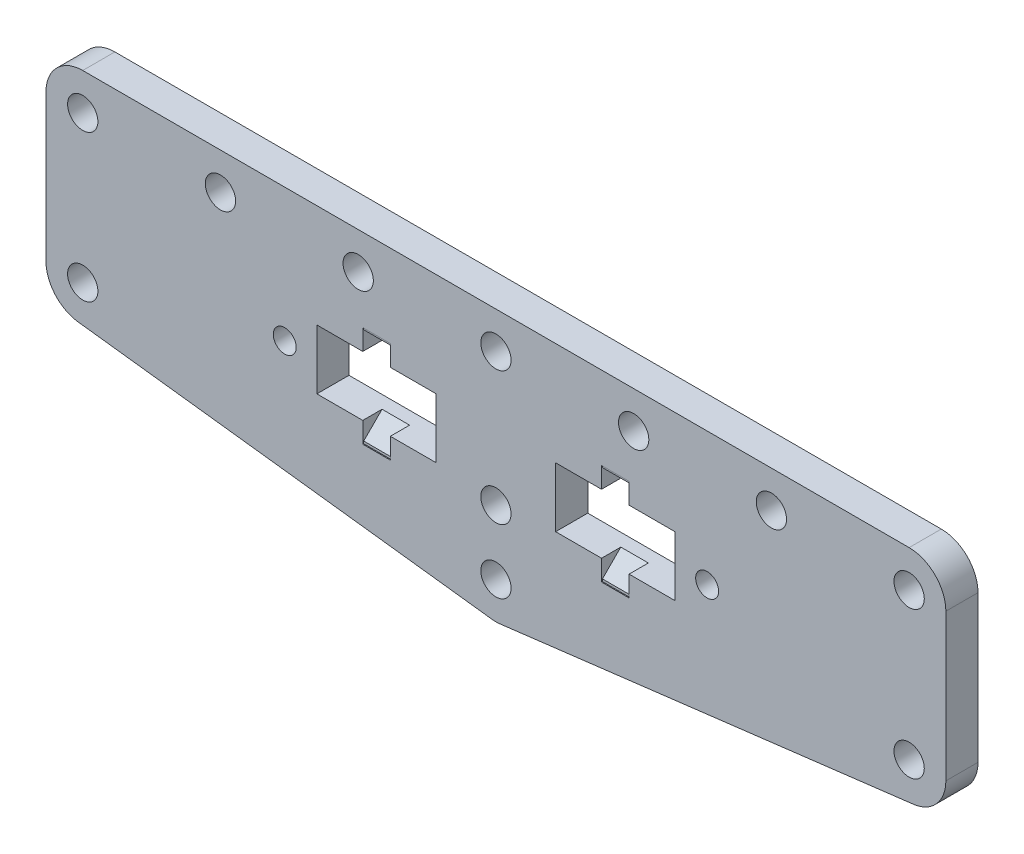
from build123d import *

# Parameters (mm, degrees)
SZKIC1_R                    = 1.65
DODANIE_WYCI_GNI_CIE1_DEPTH = 3.5
SZKIC2_W                    = 13
SZKIC2_H                    = 6.5
WYTNIJ_WYCI_GNI_CIE1_DEPTH  = 4
SZKIC3_R                    = 1.25
WYTNIJ_WYCI_GNI_CIE2_DEPTH  = 4
SZKIC4_R                    = 1.65
WYTNIJ_WYCI_GNI_CIE3_DEPTH  = 4
SZKIC5_W                    = 3
SZKIC5_H                    = 11
WYTNIJ_WYCI_GNI_CIE4_DEPTH  = 0.1
SFAZOWANIE1_SIZE            = 2
SFAZOWANIE2_SIZE            = 2


with BuildPart() as part:
    # Szkic1 → Dodanie-wyciągnięcie1 (new body)
    with BuildSketch(Plane.XY):
        with BuildLine():
            ThreePointArc((-0.48527772, -10.970454072), (0, -11), (0.48527772, -10.970454072))
            Line((0.48527772, -10.970454072), (45.48527772, -5.470454072))
            ThreePointArc((45.48527772, -5.470454072), (47.995088553, -4.151309971), (49, -1.5))
            Line((49, -1.5), (49, 14.5))
            ThreePointArc((49, 14.5), (47.828427125, 17.328427125), (45, 18.5))
            Line((45, 18.5), (-45, 18.5))
            ThreePointArc((-45, 18.5), (-47.828427125, 17.328427125), (-49, 14.5))
            Line((-49, 14.5), (-49, -1.5))
            ThreePointArc((-49, -1.5), (-47.995088553, -4.151309971), (-45.48527772, -5.470454072))
            Line((-45.48527772, -5.470454072), (-0.48527772, -10.970454072))
        make_face()
        with Locations((0, -7)):
            Circle(SZKIC1_R, mode=Mode.SUBTRACT)
        with Locations((-45, -1.5)):
            Circle(SZKIC1_R, mode=Mode.SUBTRACT)
        Circle(SZKIC1_R, mode=Mode.SUBTRACT)
        with Locations((45, -1.5)):
            Circle(SZKIC1_R, mode=Mode.SUBTRACT)
        with Locations((-45, 14.5)):
            Circle(SZKIC1_R, mode=Mode.SUBTRACT)
        with Locations((45, 14.5)):
            Circle(SZKIC1_R, mode=Mode.SUBTRACT)
    extrude(amount=DODANIE_WYCI_GNI_CIE1_DEPTH)

    # Szkic2 → Wytnij-wyciągnięcie1 (cut)
    with BuildSketch(Plane.XY.offset(3.5)):
        with Locations((13, 4)):
            Rectangle(SZKIC2_W, SZKIC2_H)
    wytnij_wyci_gni_cie1 = extrude(amount=-WYTNIJ_WYCI_GNI_CIE1_DEPTH, mode=Mode.SUBTRACT)

    # Szkic3 → Wytnij-wyciągnięcie2 (cut)
    with BuildSketch(Plane.XY.offset(3.5)):
        with Locations((23, 4)):
            Circle(SZKIC3_R)
    wytnij_wyci_gni_cie2 = extrude(amount=-WYTNIJ_WYCI_GNI_CIE2_DEPTH, mode=Mode.SUBTRACT)

    # Lustro1: Wytnij-wyciągnięcie1, Wytnij-wyciągnięcie2 across plane
    add(wytnij_wyci_gni_cie1.mirror(Plane(origin=(0, 0, 0), x_dir=(0, 0, 1), z_dir=(1, 0, 0))), mode=Mode.SUBTRACT)
    add(wytnij_wyci_gni_cie2.mirror(Plane(origin=(0, 0, 0), x_dir=(0, 0, 1), z_dir=(1, 0, 0))), mode=Mode.SUBTRACT)

    # Szkic4 → Wytnij-wyciągnięcie3 (cut)
    with BuildSketch(Plane.XY.offset(3.5)):
        with Locations((0, 14.5)):
            Circle(SZKIC4_R)
        with Locations((15, 14.5)):
            Circle(SZKIC4_R)
        with Locations((30, 14.5)):
            Circle(SZKIC4_R)
    wytnij_wyci_gni_cie3 = extrude(amount=-WYTNIJ_WYCI_GNI_CIE3_DEPTH, mode=Mode.SUBTRACT)

    # Lustro2: Wytnij-wyciągnięcie3 across plane
    add(wytnij_wyci_gni_cie3.mirror(Plane(origin=(0, 0, 0), x_dir=(0, 0, 1), z_dir=(1, 0, 0))), mode=Mode.SUBTRACT)

    # Szkic5 → Wytnij-wyciągnięcie4 (cut)
    with BuildSketch(Plane.XY.offset(3.5)):
        with Locations((13, 4)):
            Rectangle(SZKIC5_W, SZKIC5_H)
    wytnij_wyci_gni_cie4 = extrude(amount=-WYTNIJ_WYCI_GNI_CIE4_DEPTH, mode=Mode.SUBTRACT)

    # Sfazowanie1
    sfazowanie1_edges = [part.edges().sort_by_distance(p)[0] for p in [
        (13, 7.25, 3.4),
        (13, 0.75, 3.4),
    ]]
    chamfer(sfazowanie1_edges, length=SFAZOWANIE1_SIZE)

    # Lustro6: Wytnij-wyciągnięcie4 across plane
    add(wytnij_wyci_gni_cie4.mirror(Plane(origin=(0, 0, 0), x_dir=(0, 0, 1), z_dir=(1, 0, 0))), mode=Mode.SUBTRACT)

    # Sfazowanie2
    sfazowanie2_edges = [part.edges().sort_by_distance(p)[0] for p in [
        (-13, 0.75, 3.4),
        (-13, 7.25, 3.4),
    ]]
    chamfer(sfazowanie2_edges, length=SFAZOWANIE2_SIZE)


solid = part.part
